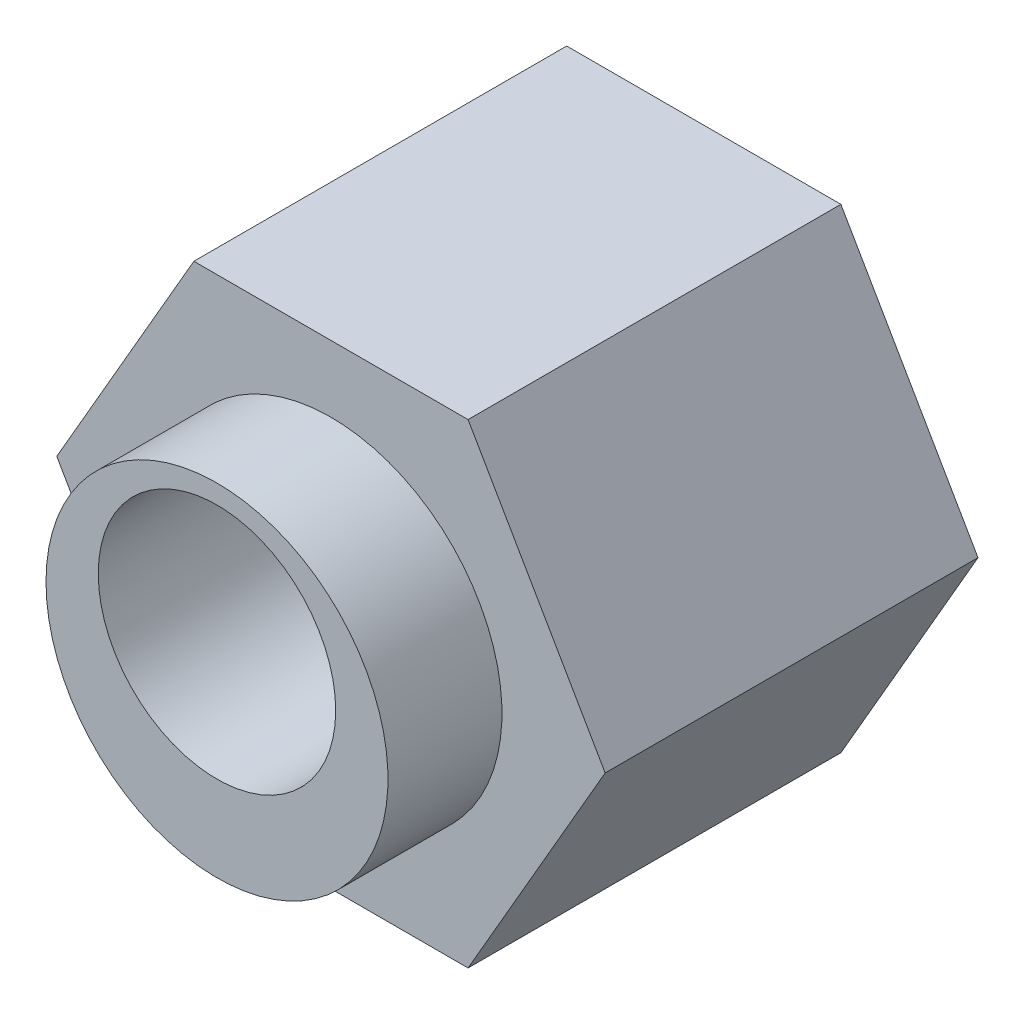
from build123d import *

# Parameters (mm, degrees)
BOSS_EXTRUDE1_DEPTH      = 7.85
SKETCH2_W                = 3.6
SKETCH2_H                = 2.4
SKETCH3_W                = 3.6
SKETCH3_H                = 0.5
F_5_0_5_DIAMETER_HOLE1_D = 5
CHAMFER1_SIZE            = 0.1


with BuildPart() as part:
    # Sketch1 → Boss-Extrude1 (new body)
    with BuildSketch(Plane(origin=(0, 0, 0.45), x_dir=(-1, 0, 0), z_dir=(0, 0, -1))):
        Polygon((2.886751346, -5), (5.773502692, 0), (2.886751346, 5), (-2.886751346, 5), (-5.773502692, 0), (-2.886751346, -5), align=None)
    extrude(amount=-BOSS_EXTRUDE1_DEPTH)

    # Sketch2 → Revolve1 (revolve)
    with BuildSketch(Plane.XZ, mode=Mode.PRIVATE) as revolve1_sk:
        with Locations((1.8, 9.5)):
            Rectangle(SKETCH2_W, SKETCH2_H)
    revolve(revolve1_sk.sketch.rotate(Axis((0, 0, 10.7), (0, 0, -1)), 180), axis=Axis((0, 0, 10.7), (0, 0, -1)))

    # Sketch3 → Revolve2 (revolve)
    with BuildSketch(Plane.XZ.offset(-0.7), mode=Mode.PRIVATE) as revolve2_sk:
        with Locations((1.8, 0.2)):
            Rectangle(SKETCH3_W, SKETCH3_H)
    revolve(revolve2_sk.sketch.rotate(Axis((0, 0.7, 0.45), (0, 0, -1)), 180), axis=Axis((0, 0.7, 0.45), (0, 0, -1)))

    # Ø5.0 (5) Diameter Hole1 (through all)
    with Locations(Plane(origin=(0, 0, -0.05), x_dir=(-1, 0, 0), z_dir=(0, 0, -1))):
        with Locations((0, 0.7)):
            Hole(F_5_0_5_DIAMETER_HOLE1_D / 2)

    # Chamfer1
    chamfer1_edges = [part.edges().sort_by_distance(p)[0] for p in [
        (3.6, 0.7, -0.05),
        (-2.5, 0.7, -0.05),
    ]]
    chamfer(chamfer1_edges, length=CHAMFER1_SIZE)


solid = part.part
